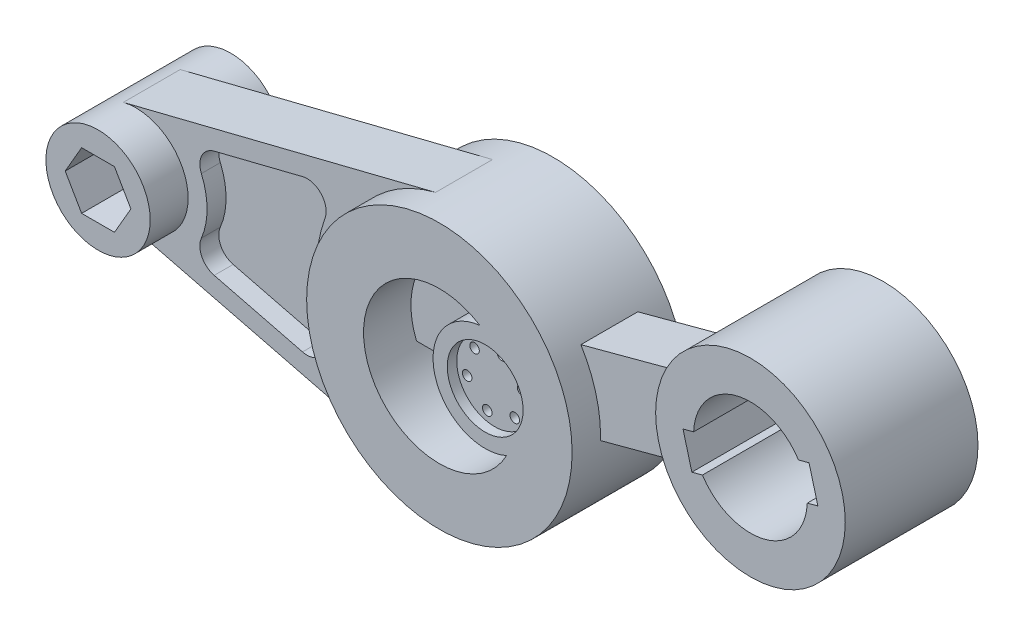
from build123d import *
from build123d.topology import SkipClean

# Parameters (mm, degrees)
LEFT_ARM_DEPTH                = 15
SKETCH2_R                     = 27.5
LEFT_BOSS_DEPTH               = 35
LEFT_HEX_DEPTH                = 265.244205
LEFT_HEX_DEPTH_BACK           = 265.244205
SKETCH3_R                     = 70
CENTRE_BOSS_DEPTH             = 30
SKETCH5_W                     = 30
SKETCH5_H                     = 40
RIGHT_ARM_DEPTH               = 175
SKETCH7_R                     = 50
RIGHT_BOSS_DEPTH              = 35
SKETCH8_R                     = 30
RIGHT_BOSS_HOLE_DEPTH         = 412.395178
SKETCH9_R                     = 40
CENTRE_HOLE_DEPTH             = 411.573979
SKETCH10_R                    = 27.5
CENTRE_BLOB_DEPTH             = 30
CENTRE_BEAM_REACH             = 243.419
SKETCH11_W                    = 10
SKETCH11_H                    = 30
CENTRE_BEAM_DIRECTION_2_REACH = 243.419
SKETCH12_R                    = 20
CUT_EXTRUDE4_DEPTH            = 5
M6X1_0_TAPPED_HOLE1_D         = 5
CIRPATTERN1_COUNT             = 6
CUT_OUT_DEPTH                 = 10
FILLET1_R                     = 10
FILLET1_OF_MIRROR2_R          = 10
KEYWAY_DEPTH                  = 407.904156


with BuildPart() as part:
    # Sketch1 → LEFT_ARM (new, symmetric)
    with BuildSketch(Plane.XY):
        with BuildLine():
            Line((-6.678571, 26.676707), (158, 67.904344))
            ThreePointArc((158, 67.904344), (245, 0), (158, -67.904344))
            Line((158, -67.904344), (-6.678571, -26.676707))
            ThreePointArc((-6.678571, -26.676707), (-27.5, 0), (-6.678571, 26.676707))
        make_face()
    extrude(amount=LEFT_ARM_DEPTH, both=True)

    # Sketch2 → LEFT_Boss (add, symmetric)
    with SkipClean():  # the faces are left unmerged after this step: merging them gives an invalid solid
        with BuildSketch(Plane.XY):
            Circle(SKETCH2_R)
        extrude(amount=LEFT_BOSS_DEPTH, both=True)

    # Sketch4 → LEFT_Hex (cut, two sides: drawn at the far end of the back side and taken through both)
    with SkipClean():  # the faces are left unmerged after this step: merging them gives an invalid solid
        with BuildSketch(Plane.XY.offset(35).offset(-LEFT_HEX_DEPTH_BACK)):
            Polygon((17.320508, 0), (8.660254, 15), (-8.660254, 15), (-17.320508, 0), (-8.660254, -15), (8.660254, -15), align=None)
        extrude(amount=LEFT_HEX_DEPTH + LEFT_HEX_DEPTH_BACK, mode=Mode.SUBTRACT)

    # Sketch3 → CENTRE_Boss (add, symmetric)
    with BuildSketch(Plane.XY):
        with Locations((175, 0)):
            Circle(SKETCH3_R)
    extrude(amount=CENTRE_BOSS_DEPTH, both=True)

    # Sketch5 → RIGHT_ARM (add)
    with BuildSketch(Plane(origin=(163.277223, 43.75, 0), x_dir=(0, 0, -1), z_dir=(0.9659258262890681, 0.25881904510252135, 0))):
        with Locations((0, -45.293333)):
            Rectangle(SKETCH5_W, SKETCH5_H)
    extrude(amount=RIGHT_ARM_DEPTH)

    # Sketch7 → RIGHT_Boss (add, symmetric)
    with BuildSketch(Plane.XY):
        with Locations((344.03702, 45.293333)):
            Circle(SKETCH7_R)
    extrude(amount=RIGHT_BOSS_DEPTH, both=True)

    # Sketch8 → RIGHT_Boss_Hole (cut, through all)
    with BuildSketch(Plane.XY.offset(35)):
        with Locations((344.03702, 45.293333)):
            Circle(SKETCH8_R)
    extrude(amount=-RIGHT_BOSS_HOLE_DEPTH, mode=Mode.SUBTRACT)

    # Sketch9 → CENTRE_Hole (cut, through all)
    with BuildSketch(Plane.XY.offset(30)):
        with Locations((175, 0)):
            Circle(SKETCH9_R)
    extrude(amount=-CENTRE_HOLE_DEPTH, mode=Mode.SUBTRACT)

    # Sketch10 → CENTRE_Blob (add, symmetric)
    with BuildSketch(Plane.XY):
        with Locations((199.148146, 6.470476)):
            Circle(SKETCH10_R)
    extrude(amount=CENTRE_BLOB_DEPTH, both=True)

    # Sketch11 → CENTRE_Beam (add, up to next)
    with BuildSketch(Plane(origin=(175, 0, 0), x_dir=(0, 0, -1), z_dir=(1, 0, 0)), mode=Mode.PRIVATE) as centre_beam_sk1:
        Rectangle(SKETCH11_W, SKETCH11_H)
    centre_beam_tool1 = extrude(centre_beam_sk1.sketch, amount=CENTRE_BEAM_REACH, mode=Mode.PRIVATE) - part.part
    add(centre_beam_tool1.solids().sort_by_distance((175, 0, 0))[0])

    # Sketch11 → CENTRE_Beam direction 2 (add, up to next)
    with BuildSketch(Plane(origin=(175, 0, 0), x_dir=(0, 0, -1), z_dir=(1, 0, 0)), mode=Mode.PRIVATE) as centre_beam_direction_2_sk1:
        Rectangle(SKETCH11_W, SKETCH11_H)
    centre_beam_direction_2_tool1 = extrude(centre_beam_direction_2_sk1.sketch, amount=-CENTRE_BEAM_DIRECTION_2_REACH, mode=Mode.PRIVATE) - part.part
    add(centre_beam_direction_2_tool1.solids().sort_by_distance((175, 0, 0))[0])

    # Sketch12 → Cut-Extrude4 (cut)
    with BuildSketch(Plane.XY.offset(30)):
        with Locations((199.148146, 6.470476)):
            Circle(SKETCH12_R)
    cut_extrude4 = extrude(amount=-CUT_EXTRUDE4_DEPTH, mode=Mode.SUBTRACT)

    # M6x1.0 Tapped Hole1 (through all)
    with Locations(Plane.XY.offset(25)):
        with Locations((184.659258, 2.58819)):
            m6x1_0_tapped_hole1 = Hole(M6X1_0_TAPPED_HOLE1_D / 2)

    # CirPattern1: M6x1.0 Tapped Hole1 ×6 about axis
    cirpattern1_axis = Axis((199.148146, 6.470476, 0), (0, 0, 1))
    for i in range(1, CIRPATTERN1_COUNT):
        add(m6x1_0_tapped_hole1.rotate(cirpattern1_axis, i * 360 / CIRPATTERN1_COUNT), mode=Mode.SUBTRACT)

    # Mirror1: Cut-Extrude4 across plane
    add(cut_extrude4.mirror(Plane.XY), mode=Mode.SUBTRACT)

    # Sketch15 → Cut_OUT (cut)
    with BuildSketch(Plane.XY.offset(15)):
        with BuildLine():
            Line((109.097712, 45.352932), (27.923319, 25.030746))
            ThreePointArc((27.923319, 25.030746), (37.5, 0), (27.923319, -25.030746))
            Line((27.923319, -25.030746), (109.097712, -45.352932))
            ThreePointArc((109.097712, -45.352932), (95, 0), (109.097712, 45.352932))
        make_face()
    cut_out = extrude(amount=-CUT_OUT_DEPTH, mode=Mode.SUBTRACT)

    # Fillet1
    fillet1_edges = [part.edges().sort_by_distance(p)[0] for p in [
        (27.923319, -25.030746, 10),
        (27.923319, 25.030746, 10),
        (109.097712, 45.352932, 10),
        (109.097712, -45.352932, 10),
    ]]
    fillet(fillet1_edges, radius=FILLET1_R)

    # Mirror2: Cut_OUT across plane
    with SkipClean():  # the faces are left unmerged after this step: merging them gives an invalid solid
        add(cut_out.mirror(Plane.XY), mode=Mode.SUBTRACT)

    # Fillet1 of Mirror2
    fillet1_of_mirror2_edges = [part.edges().sort_by_distance(p)[0] for p in [
        (27.923319, -25.030746, -10),
        (27.923319, 25.030746, -10),
        (109.097712, 45.352932, -10),
        (109.097712, -45.352932, -10),
    ]]
    fillet(fillet1_of_mirror2_edges, radius=FILLET1_OF_MIRROR2_R)

    # Sketch16 → KEYWAY (cut, symmetric)
    with SkipClean():  # the faces are left unmerged after this step: merging them gives an invalid solid
        with BuildSketch(Plane.XY):
            Polygon((346.366391, 36.6), (341.707648, 53.986665), (308.4798, 45.08329), (313.138543, 27.696625), align=None)
        keyway = extrude(amount=KEYWAY_DEPTH, both=True, mode=Mode.SUBTRACT)

    # Mirror3: KEYWAY across plane
    with SkipClean():  # the faces are left unmerged after this step: merging them gives an invalid solid
        add(keyway.mirror(Plane(origin=(332.314242, 89.043333, 0), x_dir=(0, 0, 1), z_dir=(0.9659258262890681, 0.25881904510252135, 0))), mode=Mode.SUBTRACT)


solid = part.part
